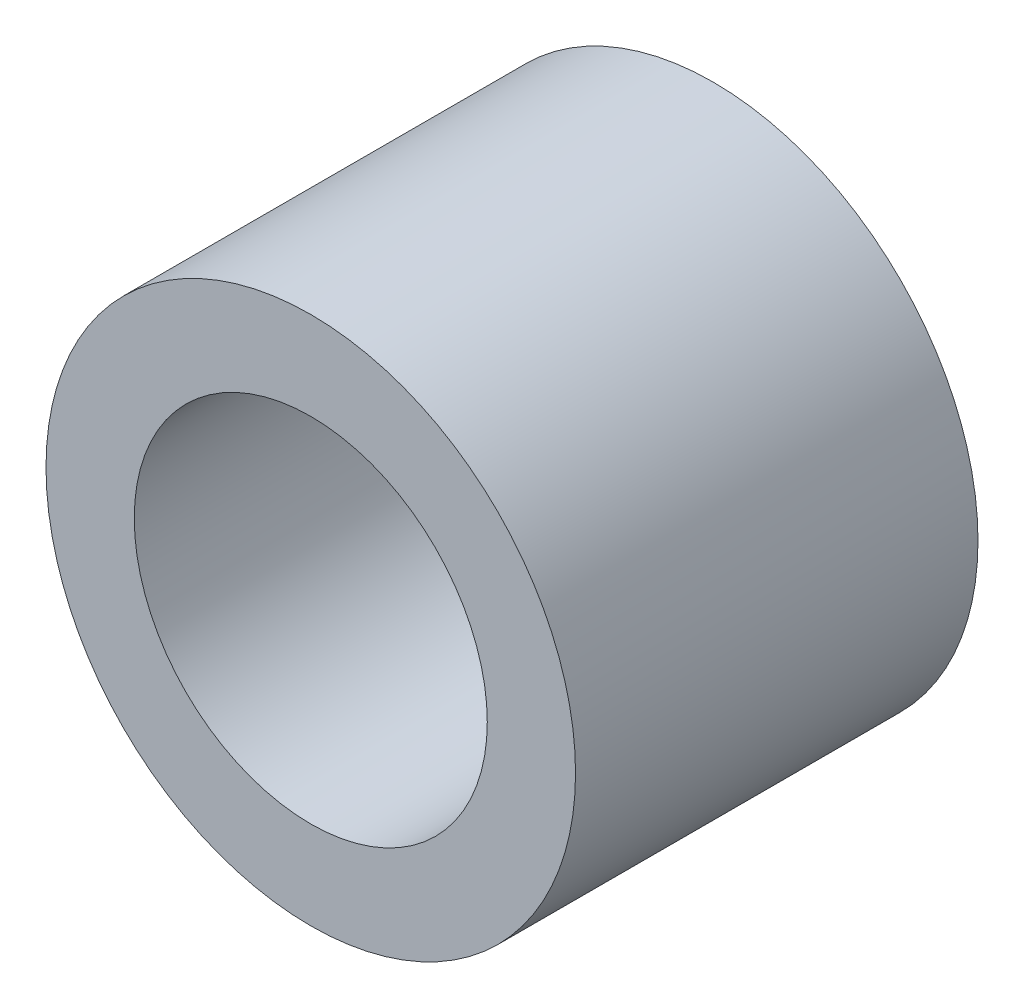
from build123d import *

# Parameters (mm, degrees)
SKIZZE1_R                          = 7.5
SKIZZE1_R_2                        = 5
AUFSATZ_LINEAR_AUSTRAGEN1_DEPTH    = 11.4
K_RPER_VERSCHIEBEN_KOPIEREN1_ANGLE = 90


with BuildPart() as part:
    # Skizze1 → Aufsatz-Linear austragen1 (new body)
    with BuildSketch(Plane(origin=(0, 0, 0), x_dir=(1, 0, 0), z_dir=(0, 1, 0))):
        with Locations(Location((0, 0, 0), (0, 0, 270))):
            Circle(SKIZZE1_R)
        with Locations(Location((0, 0, 0), (0, 0, 270))):
            Circle(SKIZZE1_R_2, mode=Mode.SUBTRACT)
    extrude(amount=AUFSATZ_LINEAR_AUSTRAGEN1_DEPTH)


with BuildPart() as part_1:
    # Körper-Verschieben/Kopieren1: moved
    add(part.part.rotate(Axis((0, 5.7, 0), (-1, 0, 0)), K_RPER_VERSCHIEBEN_KOPIEREN1_ANGLE))


solid = part_1.part
